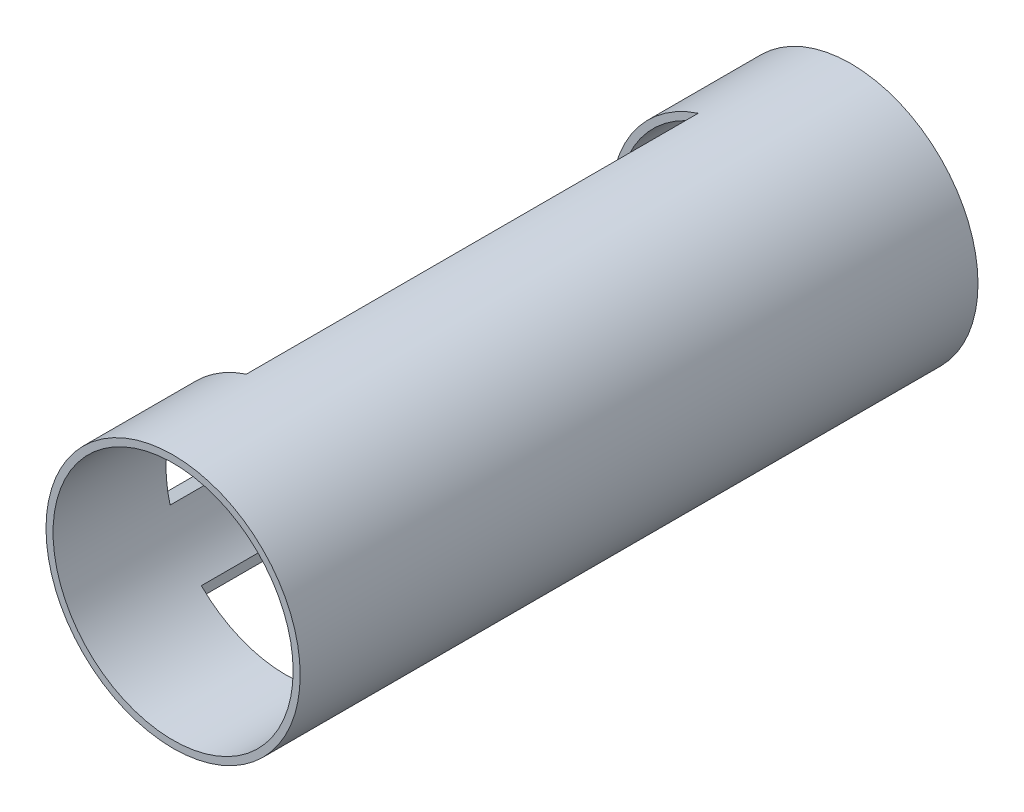
from build123d import *

# Parameters (mm, degrees)
SKETCH1_R      = 57.15
SKETCH1_R_2    = 53.975
EXTRUDE1_DEPTH = 304.8
SKETCH2_W      = 76.2
SKETCH2_H      = 203.2
EXTRUDE2_DEPTH = 316.333609056
SKETCH3_W      = 203.2
SKETCH3_H      = 76.2
EXTRUDE3_DEPTH = 316.333609056


with BuildPart() as part:
    # Sketch1 → Extrude1 (new body)
    with BuildSketch(Plane.XY):
        with Locations(Location((0, 0, 0), (0, 0, 180))):
            Circle(SKETCH1_R)
        with Locations(Location((0, 0, 0), (0, 0, 180))):
            Circle(SKETCH1_R_2, mode=Mode.SUBTRACT)
    extrude(amount=EXTRUDE1_DEPTH)

    # Sketch2 → Extrude2 (cut, through all)
    with BuildSketch(Plane(origin=(0, 0, 0), x_dir=(1, 0, 0), z_dir=(0, 1, 0))):
        with Locations((0, -152.4)):
            Rectangle(SKETCH2_W, SKETCH2_H)
    extrude(amount=-EXTRUDE2_DEPTH, mode=Mode.SUBTRACT)

    # Sketch3 → Extrude3 (cut, through all)
    with BuildSketch(Plane(origin=(0, 0, 0), x_dir=(0, 0, -1), z_dir=(0.8660254037844365, -0.500000000000004, 0))):
        with Locations((-152.4, 0)):
            Rectangle(SKETCH3_W, SKETCH3_H)
    extrude(amount=-EXTRUDE3_DEPTH, mode=Mode.SUBTRACT)


solid = part.part
